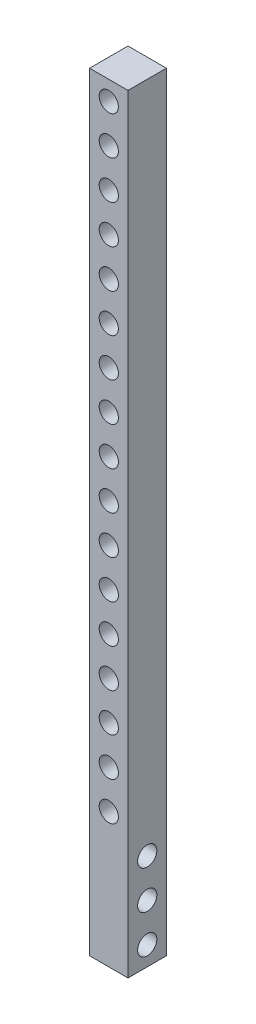
from build123d import *

# Parameters (mm, degrees)
ESQUISSE1_W             = 10
ESQUISSE1_H             = 200
ESQUISSE1_R             = 2.5
BASE_DEPTH              = 10
ESQUISSE4_R             = 2.5
ENL_V_MAT_EXTRU_2_DEPTH = 101.995049384


with BuildPart() as part:
    # Esquisse1 → BASE (new body)
    with BuildSketch(Plane.XY):
        Rectangle(ESQUISSE1_W, ESQUISSE1_H)
        with Locations((0, 95)):
            Circle(ESQUISSE1_R, mode=Mode.SUBTRACT)
        with Locations((0, 85)):
            Circle(ESQUISSE1_R, mode=Mode.SUBTRACT)
        with Locations((0, 75)):
            Circle(ESQUISSE1_R, mode=Mode.SUBTRACT)
        with Locations((0, 65)):
            Circle(ESQUISSE1_R, mode=Mode.SUBTRACT)
        with Locations((0, 55)):
            Circle(ESQUISSE1_R, mode=Mode.SUBTRACT)
        with Locations((0, 45)):
            Circle(ESQUISSE1_R, mode=Mode.SUBTRACT)
        with Locations((0, 35)):
            Circle(ESQUISSE1_R, mode=Mode.SUBTRACT)
        with Locations((0, 25)):
            Circle(ESQUISSE1_R, mode=Mode.SUBTRACT)
        with Locations((0, 15)):
            Circle(ESQUISSE1_R, mode=Mode.SUBTRACT)
        with Locations((0, 5)):
            Circle(ESQUISSE1_R, mode=Mode.SUBTRACT)
        with Locations((0, -5)):
            Circle(ESQUISSE1_R, mode=Mode.SUBTRACT)
        with Locations((0, -15)):
            Circle(ESQUISSE1_R, mode=Mode.SUBTRACT)
        with Locations((0, -25)):
            Circle(ESQUISSE1_R, mode=Mode.SUBTRACT)
        with Locations((0, -35)):
            Circle(ESQUISSE1_R, mode=Mode.SUBTRACT)
        with Locations((0, -45)):
            Circle(ESQUISSE1_R, mode=Mode.SUBTRACT)
        with Locations((0, -55)):
            Circle(ESQUISSE1_R, mode=Mode.SUBTRACT)
        with Locations((0, -65)):
            Circle(ESQUISSE1_R, mode=Mode.SUBTRACT)
    extrude(amount=BASE_DEPTH)

    # Esquisse4 → Enlèv. mat.-Extru.2 (cut, through all)
    with BuildSketch(Plane.ZY.offset(5)):
        with Locations(Location((5, -95, 0), (0, 0, 270))):
            Circle(ESQUISSE4_R)
        with Locations(Location((5, -85, 0), (0, 0, 270))):
            Circle(ESQUISSE4_R)
        with Locations(Location((5, -75, 0), (0, 0, 270))):
            Circle(ESQUISSE4_R)
    extrude(amount=-ENL_V_MAT_EXTRU_2_DEPTH, mode=Mode.SUBTRACT)


solid = part.part
